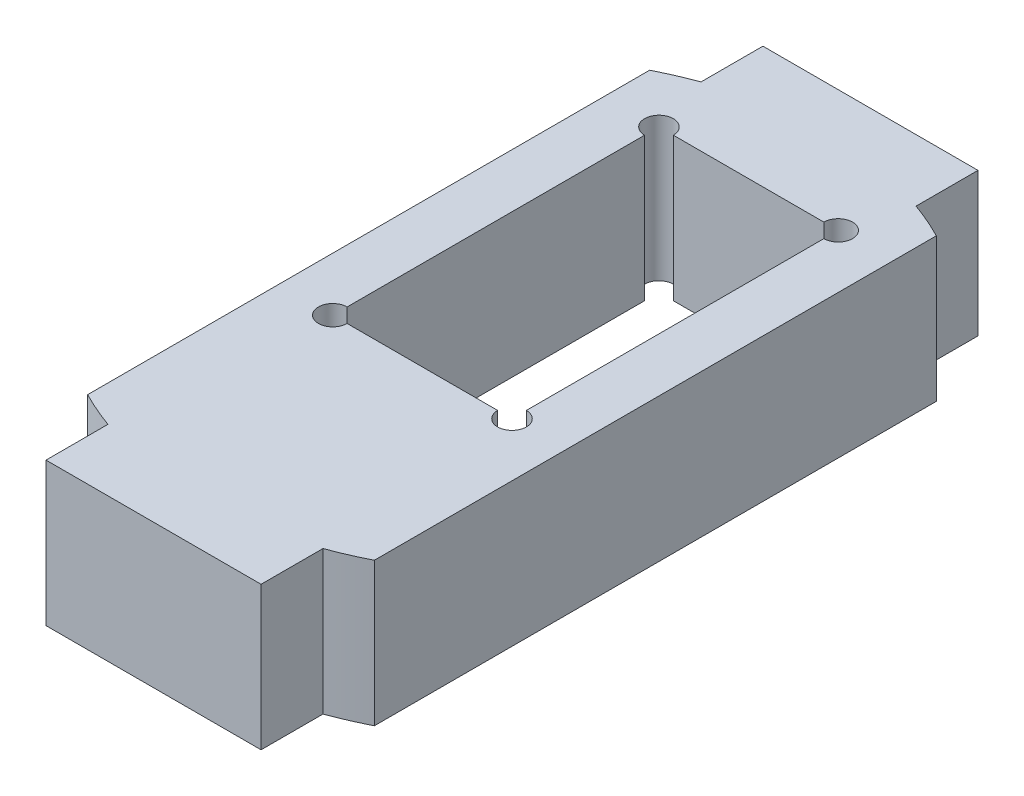
from build123d import *

# Parameters (mm, degrees)
RESSALTO_EXTRUS_O1_DEPTH = 10
CORTE_EXTRUS_O1_DEPTH    = 29.722813233


with BuildPart() as part:
    # Esboço1 → Ressalto-extrusão1 (new body)
    with BuildSketch(Plane(origin=(0, 0, 0), x_dir=(1, 0, 0), z_dir=(0, 1, 0))):
        with BuildLine():
            Line((-7.5, 20.68211788), (-7.5, 25))
            Line((-7.5, 25), (7.5, 25))
            Line((7.5, 25), (7.5, 20.68211788))
            ThreePointArc((7.5, 20.68211788), (8.766838517, 20.177773475), (10, 19.595917942))
            Line((10, 19.595917942), (10, -19.595917942))
            ThreePointArc((10, -19.595917942), (8.766838517, -20.177773475), (7.5, -20.68211788))
            Line((7.5, -20.68211788), (7.5, -25))
            Line((7.5, -25), (-7.5, -25))
            Line((-7.5, -25), (-7.5, -20.68211788))
            ThreePointArc((-7.5, -20.68211788), (-8.766838517, -20.177773475), (-10, -19.595917942))
            Line((-10, -19.595917942), (-10, 19.595917942))
            ThreePointArc((-10, 19.595917942), (-8.766838517, 20.177773475), (-7.5, 20.68211788))
        make_face()
    extrude(amount=RESSALTO_EXTRUS_O1_DEPTH)

    # Esboço2 → Corte-extrusão1 (cut, through all)
    with BuildSketch(Plane(origin=(0, 10, 0), x_dir=(1, 0, 0), z_dir=(0, 1, 0))):
        with BuildLine():
            Line((5.25, 16.5), (-5.25, 16.5))
            ThreePointArc((-5.25, 16.5), (-6.957106781, 17.207106781), (-6.25, 15.5))
            Line((-6.25, 15.5), (-6.25, -5.25))
            ThreePointArc((-6.25, -5.25), (-6.957106781, -6.957106781), (-5.25, -6.25))
            Line((-5.25, -6.25), (5.25, -6.25))
            ThreePointArc((5.25, -6.25), (6.957106781, -6.957106781), (6.25, -5.25))
            Line((6.25, -5.25), (6.25, 15.5))
            ThreePointArc((6.25, 15.5), (6.957106781, 17.207106781), (5.25, 16.5))
        make_face()
    extrude(amount=-CORTE_EXTRUS_O1_DEPTH, mode=Mode.SUBTRACT)


solid = part.part
